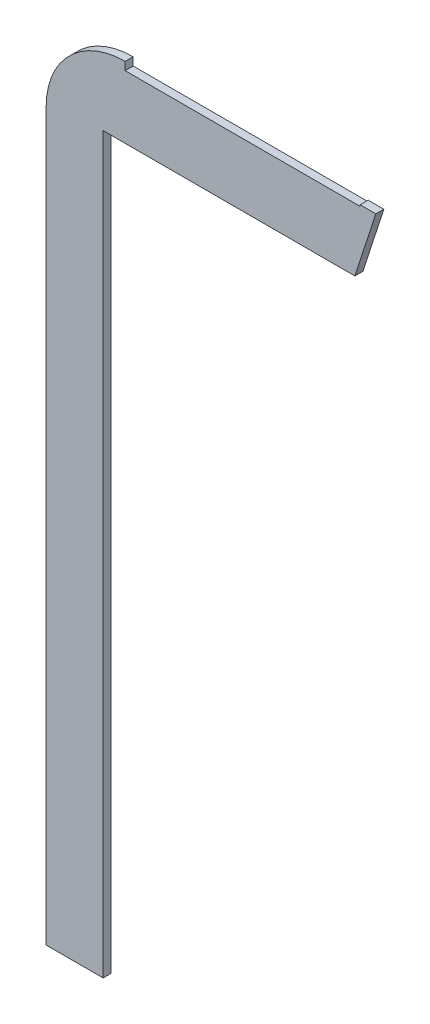
from build123d import *

# Parameters (mm, degrees)
BOSS_EXTRUDE1_DEPTH = 3
BOSS_EXTRUDE2_DEPTH = 3
SKETCH3_W           = 87.73773678
SKETCH3_H           = 3.000342445
CUT_EXTRUDE1_DEPTH  = 300


with BuildPart() as part:
    # Sketch1 → Boss-Extrude1 (new body)
    with BuildSketch(Plane.XY):
        with BuildLine():
            Line((93.97826087, 269), (101.804347826, 293))
            Line((101.804347826, 293), (20.086056782, 293))
            ThreePointArc((20.086056782, 293), (-7.9185527, 290.707315192), (-21.3, 266))
            Line((-21.3, 266), (-21.3, -5))
            Line((-21.3, -5), (0, -5))
            Line((0, -5), (0, 269))
            Line((0, 269), (93.97826087, 269))
        make_face()
    extrude(amount=BOSS_EXTRUDE1_DEPTH)

    # Sketch2 → Boss-Extrude2 (add)
    with BuildSketch(Plane.XY.offset(3)):
        Polygon((8.199539928, 295.500342445), (95.938079236, 295.500342445), (95.938079236, 293), (8.804994825, 293), align=None)
    extrude(amount=-BOSS_EXTRUDE2_DEPTH)

    # Sketch3 → Cut-Extrude1 (cut)
    with BuildSketch(Plane(origin=(0, 0, 0), x_dir=(-1, 0, 0), z_dir=(0, 0, -1))):
        with Locations((-52.069210846, 294.000171223)):
            Rectangle(SKETCH3_W, SKETCH3_H)
    extrude(amount=-CUT_EXTRUDE1_DEPTH, mode=Mode.SUBTRACT)


solid = part.part
